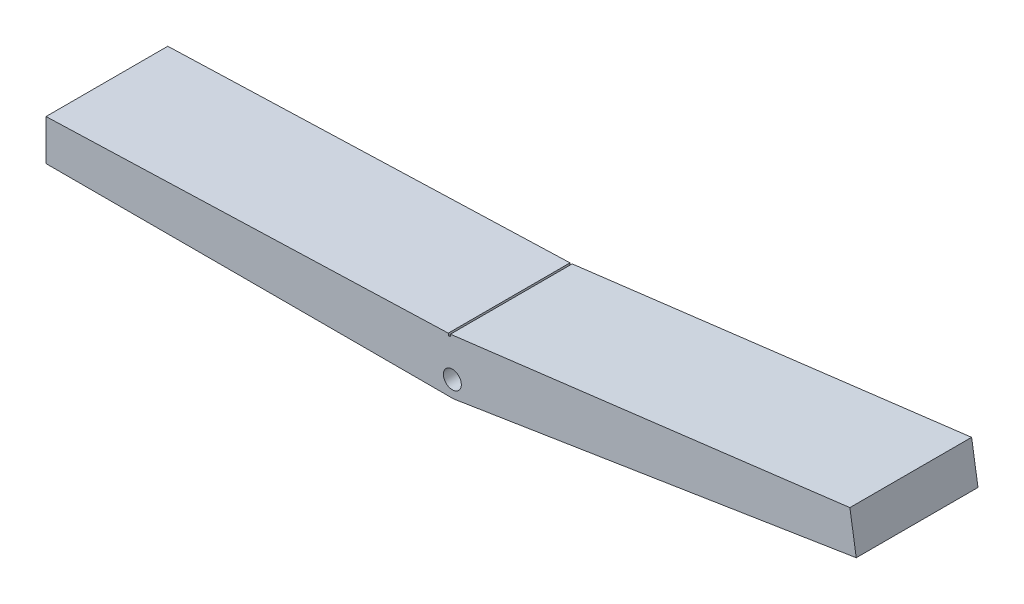
from build123d import *

# Parameters (mm, degrees)
SKETCH1_R           = 1.65
BOSS_EXTRUDE1_DEPTH = 22.4
SKETCH2_R           = 3.05
CUT_EXTRUDE1_DEPTH  = 3
CUT_EXTRUDE2_REACH  = 81.517
SKETCH3_W           = 0.4
SKETCH3_H           = 22.4


with BuildPart() as part:
    # Sketch1 → Boss-Extrude1 (new body)
    with BuildSketch(Plane.XY):
        Polygon((0, 0), (-75, 0), (-75, 7.5), (-0.787017068, 10), (72.903367057, 19.140247432), (74.076625545, 11.732584878), align=None)
        with Locations((-0.235377287, 2.990752001)):
            Circle(SKETCH1_R, mode=Mode.SUBTRACT)
    extrude(amount=BOSS_EXTRUDE1_DEPTH)

    # Sketch2 → Cut-Extrude1 (cut)
    with BuildSketch(Plane(origin=(0, 0, 0), x_dir=(0.9876883405951377, 0.15643446504023117, 0), z_dir=(0.1564344650402312, -0.9876883405951378, 0))):
        with Locations((67, 14.7)):
            Circle(SKETCH2_R)
        with Locations((67, 7.7)):
            Circle(SKETCH2_R)
    cut_extrude1 = extrude(amount=-CUT_EXTRUDE1_DEPTH, mode=Mode.SUBTRACT)

    # Mirror1: Cut-Extrude1 across plane
    add(cut_extrude1.mirror(Plane(origin=(0, 0, 0), x_dir=(0, 0, 1), z_dir=(0.9969173337331281, 0.07845909572784505, 0))), mode=Mode.SUBTRACT)

    # Cut-Extrude2: up to this plane
    cut_extrude2_end = Plane(origin=(-0.773549976, 9.600226767, 22.4), z_dir=(0.03366773042207346, -0.9994330812656876, 0))
    # Sketch3 → Cut-Extrude2 (cut, up to the surface)
    with BuildSketch(Plane(origin=(-1.048316472, 13.320123716, 0), x_dir=(0.9969173337331281, 0.07845909572784511, 0), z_dir=(-0.07845909572784511, 0.9969173337331281, 0)), mode=Mode.PRIVATE) as cut_extrude2_sk1:
        with Locations((0, -11.2)):
            Rectangle(SKETCH3_W, SKETCH3_H)
    cut_extrude2_tool1 = split(extrude(cut_extrude2_sk1.sketch, amount=-CUT_EXTRUDE2_REACH, mode=Mode.PRIVATE), bisect_by=cut_extrude2_end, keep=Keep.BOTH, mode=Mode.PRIVATE)
    add(cut_extrude2_tool1.solids().sort_by_distance((-1.048316, 13.320124, 11.2))[0], mode=Mode.SUBTRACT)


solid = part.part
